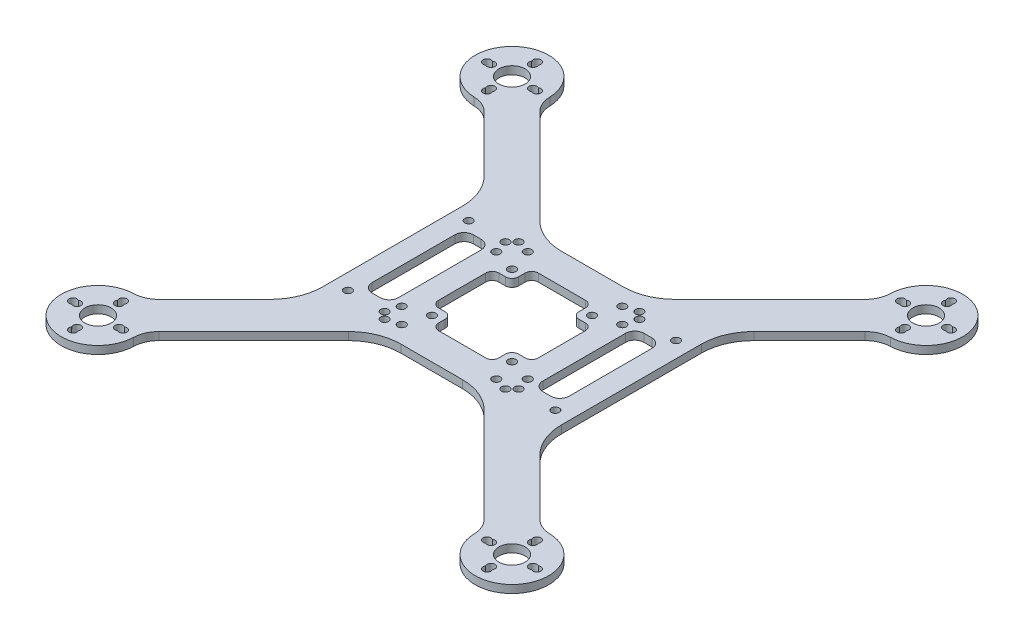
from build123d import *

# Parameters (mm, degrees)
SKETCH_1_R                 = 1.5
EXTRUDE_1_DEPTH            = 3
SKETCH_2_R                 = 1.5
SKETCH_2_R_2               = 5
EXTRUDE_2_DEPTH            = 3
MIRROR_5_COPY_1_SKETCH_R   = 1.5
MIRROR_5_COPY_1_SKETCH_R_2 = 5
MIRROR_5_COPY_1_DEPTH      = 3
FILLET_4_R                 = 20
SKETCH_3_R                 = 1.5
SKETCH_3_W                 = 10
SKETCH_3_H                 = 38.5
CUT_EXTRUDE_1_DEPTH        = 132.333258323
FILLET_6_R                 = 3.5
FILLET_7_R                 = 2.5
SKETCH_4_R                 = 1.5
CUT_EXTRUDE_2_DEPTH        = 132.333258323
PATTERN_CIRCULAR_1_COUNT   = 4


with BuildPart() as part:
    # 草图1 → 凸台-拉伸1 (new body)
    with BuildSketch(Plane(origin=(0, 0, 0), x_dir=(1, 0, 0), z_dir=(0, 1, 0))):
        with BuildLine():
            Line((-42.5, 30.6), (42.5, 30.6))
            ThreePointArc((42.5, 30.6), (44.621320344, 29.721320344), (45.5, 27.6))
            Line((45.5, 27.6), (45.5, -27.6))
            ThreePointArc((45.5, -27.6), (44.621320344, -29.721320344), (42.5, -30.6))
            Line((42.5, -30.6), (-42.5, -30.6))
            ThreePointArc((-42.5, -30.6), (-44.621320344, -29.721320344), (-45.5, -27.6))
            Line((-45.5, -27.6), (-45.5, 27.6))
            ThreePointArc((-45.5, 27.6), (-44.621320344, 29.721320344), (-42.5, 30.6))
        make_face()
        with Locations(Location((-39.5, 23, 0), (0, 0, 270))):
            Circle(SKETCH_1_R, mode=Mode.SUBTRACT)
        with Locations(Location((-25.5, 23, 0), (0, 0, 270))):
            Circle(SKETCH_1_R, mode=Mode.SUBTRACT)
        with Locations(Location((25.5, 23, 0), (0, 0, 270))):
            Circle(SKETCH_1_R, mode=Mode.SUBTRACT)
        with Locations(Location((39.5, 23, 0), (0, 0, 270))):
            Circle(SKETCH_1_R, mode=Mode.SUBTRACT)
        with Locations(Location((-39.5, -23, 0), (0, 0, 270))):
            Circle(SKETCH_1_R, mode=Mode.SUBTRACT)
        with Locations(Location((-25.5, -23, 0), (0, 0, 270))):
            Circle(SKETCH_1_R, mode=Mode.SUBTRACT)
        with Locations(Location((25.5, -23, 0), (0, 0, 270))):
            Circle(SKETCH_1_R, mode=Mode.SUBTRACT)
        with Locations(Location((39.5, -23, 0), (0, 0, 270))):
            Circle(SKETCH_1_R, mode=Mode.SUBTRACT)
        with Locations(Location((-18, 24, 0), (0, 0, 270))):
            Circle(SKETCH_1_R, mode=Mode.SUBTRACT)
        with Locations(Location((18, 24, 0), (0, 0, 270))):
            Circle(SKETCH_1_R, mode=Mode.SUBTRACT)
        with Locations(Location((-18, -24, 0), (0, 0, 270))):
            Circle(SKETCH_1_R, mode=Mode.SUBTRACT)
        with Locations(Location((18, -24, 0), (0, 0, 270))):
            Circle(SKETCH_1_R, mode=Mode.SUBTRACT)
        with Locations(Location((24, -18, 0), (0, 0, 270))):
            Circle(SKETCH_1_R, mode=Mode.SUBTRACT)
        with Locations(Location((24, 18, 0), (0, 0, 270))):
            Circle(SKETCH_1_R, mode=Mode.SUBTRACT)
        with Locations(Location((-24, 18, 0), (0, 0, 270))):
            Circle(SKETCH_1_R, mode=Mode.SUBTRACT)
        with Locations(Location((-24, -18, 0), (0, 0, 270))):
            Circle(SKETCH_1_R, mode=Mode.SUBTRACT)
        with Locations(Location((-23, 25.5, 0), (0, 0, 270))):
            Circle(SKETCH_1_R, mode=Mode.SUBTRACT)
        with Locations(Location((-23, -25.5, 0), (0, 0, 270))):
            Circle(SKETCH_1_R, mode=Mode.SUBTRACT)
        with Locations(Location((23, 25.5, 0), (0, 0, 270))):
            Circle(SKETCH_1_R, mode=Mode.SUBTRACT)
        with Locations(Location((23, -25.5, 0), (0, 0, 270))):
            Circle(SKETCH_1_R, mode=Mode.SUBTRACT)
    extrude(amount=EXTRUDE_1_DEPTH)

    # 草图2 → 凸台-拉伸2 (add)
    with BuildSketch(Plane(origin=(0, 3, 0), x_dir=(1, 0, 0), z_dir=(0, 1, 0))):
        with BuildLine():
            Line((-61.925535594, 72.532137312), (-19.993398282, 30.6))
            Line((-19.993398282, 30.6), (-45.5, 23.412283477))
            Line((-45.5, 23.412283477), (-45.5, 26.609127035))
            ThreePointArc((-45.5, 26.609127035), (-47.02240935, 34.262795682), (-51.357864376, 40.751262658))
            Line((-51.357864376, 40.751262658), (-72.532137312, 61.925535594))
            ThreePointArc((-72.532137312, 61.925535594), (-75.630398524, 64.031439381), (-79.286205531, 64.849442082))
            ThreePointArc((-79.286205531, 64.849442082), (-88.741901039, 88.741901039), (-64.849442082, 79.286205531))
            ThreePointArc((-64.849442082, 79.286205531), (-64.031439381, 75.630398524), (-61.925535594, 72.532137312))
        make_face()
        with Locations(Location((-78.842406102, 88.342406102, 0), (0, 0, 270))):
            Circle(SKETCH_2_R, mode=Mode.SUBTRACT)
        with Locations(Location((-69.342406102, 78.842406102, 0), (0, 0, 270))):
            Circle(SKETCH_2_R, mode=Mode.SUBTRACT)
        with Locations(Location((-78.842406102, 69.342406102, 0), (0, 0, 270))):
            Circle(SKETCH_2_R, mode=Mode.SUBTRACT)
        with Locations(Location((-88.342406102, 78.842406102, 0), (0, 0, 270))):
            Circle(SKETCH_2_R, mode=Mode.SUBTRACT)
        with Locations(Location((-78.842406102, 78.842406102, 0), (0, 0, 270))):
            Circle(SKETCH_2_R_2, mode=Mode.SUBTRACT)
    extrude_2 = extrude(amount=-EXTRUDE_2_DEPTH)

    # 镜向4: 凸台-拉伸2 across plane
    add(extrude_2.mirror(Plane.XY))

    # 镜向5: 凸台-拉伸2 across plane
    add(extrude_2.mirror(Plane(origin=(0, 0, 0), x_dir=(0, 0, 1), z_dir=(1, 0, 0))))

    # 镜向5 copy 1 sketch → 镜向5 copy 1 (add)
    with BuildSketch(Plane(origin=(0, 3, 0), x_dir=(-1, 0, 0), z_dir=(0, 1, 0))):
        with BuildLine():
            Line((-61.925535594, 72.532137312), (-19.993398282, 30.6))
            Line((-19.993398282, 30.6), (-45.5, 23.412283477))
            Line((-45.5, 23.412283477), (-45.5, 26.609127035))
            ThreePointArc((-45.5, 26.609127035), (-47.02240935, 34.262795682), (-51.357864376, 40.751262658))
            Line((-51.357864376, 40.751262658), (-72.532137312, 61.925535594))
            ThreePointArc((-72.532137312, 61.925535594), (-75.630398524, 64.031439381), (-79.286205531, 64.849442082))
            ThreePointArc((-79.286205531, 64.849442082), (-88.741901039, 88.741901039), (-64.849442082, 79.286205531))
            ThreePointArc((-64.849442082, 79.286205531), (-64.031439381, 75.630398524), (-61.925535594, 72.532137312))
        make_face()
        with Locations(Location((-78.842406102, 88.342406102, 0), (0, 0, 270))):
            Circle(MIRROR_5_COPY_1_SKETCH_R, mode=Mode.SUBTRACT)
        with Locations(Location((-69.342406102, 78.842406102, 0), (0, 0, 270))):
            Circle(MIRROR_5_COPY_1_SKETCH_R, mode=Mode.SUBTRACT)
        with Locations(Location((-78.842406102, 69.342406102, 0), (0, 0, 270))):
            Circle(MIRROR_5_COPY_1_SKETCH_R, mode=Mode.SUBTRACT)
        with Locations(Location((-88.342406102, 78.842406102, 0), (0, 0, 270))):
            Circle(MIRROR_5_COPY_1_SKETCH_R, mode=Mode.SUBTRACT)
        with Locations(Location((-78.842406102, 78.842406102, 0), (0, 0, 270))):
            Circle(MIRROR_5_COPY_1_SKETCH_R_2, mode=Mode.SUBTRACT)
    extrude(amount=-MIRROR_5_COPY_1_DEPTH)

    # 圆角4
    fillet_4_edges = [part.edges().sort_by_distance(p)[0] for p in [
        (-19.993398282, 1.5, -30.6),
        (-19.993398282, 1.5, 30.6),
        (19.993398282, 1.5, -30.6),
        (19.993398282, 1.5, 30.6),
    ]]
    fillet(fillet_4_edges, radius=FILLET_4_R)

    # 草图3 → 切除-拉伸1 (cut, through all)
    with BuildSketch(Plane(origin=(0, 3, 0), x_dir=(1, 0, 0), z_dir=(0, 1, 0))):
        with Locations(Location((15.25, 15.25, 0), (0, 0, 270))):
            Circle(SKETCH_3_R)
        with Locations(Location((15.25, -15.25, 0), (0, 0, 270))):
            Circle(SKETCH_3_R)
        with Locations(Location((-15.25, 15.25, 0), (0, 0, 270))):
            Circle(SKETCH_3_R)
        with Locations(Location((-15.25, -15.25, 0), (0, 0, 270))):
            Circle(SKETCH_3_R)
        Polygon((-11.5, 19), (11.5, 19), (11.5, 11.5), (19, 11.5), (19, -11.5), (11.5, -11.5), (11.5, -19), (-11.5, -19), (-11.5, -11.5), (-19, -11.5), (-19, 11.5), (-11.5, 11.5), align=None)
        with Locations((32.5, 0)):
            Rectangle(SKETCH_3_W, SKETCH_3_H)
        with Locations((-32.5, 0)):
            Rectangle(SKETCH_3_W, SKETCH_3_H)
    extrude(amount=-CUT_EXTRUDE_1_DEPTH, mode=Mode.SUBTRACT)

    # 圆角6
    fillet_6_edges = [part.edges().sort_by_distance(p)[0] for p in [
        (27.5, 1.5, 19.25),
        (27.5, 1.5, -19.25),
        (37.5, 1.5, -19.25),
        (37.5, 1.5, 19.25),
        (-27.5, 1.5, 19.25),
        (-37.5, 1.5, 19.25),
        (-37.5, 1.5, -19.25),
        (-27.5, 1.5, -19.25),
    ]]
    fillet(fillet_6_edges, radius=FILLET_6_R)

    # 圆角7
    fillet_7_edges = [part.edges().sort_by_distance(p)[0] for p in [
        (11.5, 1.5, -19),
        (11.5, 1.5, -11.5),
        (19, 1.5, -11.5),
        (19, 1.5, 11.5),
        (11.5, 1.5, 11.5),
        (11.5, 1.5, 19),
        (-11.5, 1.5, 19),
        (-11.5, 1.5, 11.5),
        (-19, 1.5, 11.5),
        (-19, 1.5, -11.5),
        (-11.5, 1.5, -11.5),
        (-11.5, 1.5, -19),
    ]]
    fillet(fillet_7_edges, radius=FILLET_7_R)

    # 草图4 → 切除-拉伸2 (cut, through all)
    with BuildSketch(Plane(origin=(0, 3, 0), x_dir=(1, 0, 0), z_dir=(0, 1, 0))):
        with Locations((-70.842406102, 78.842406102)):
            Circle(SKETCH_4_R)
        with Locations((-78.842406102, 70.842406102)):
            Circle(SKETCH_4_R)
        with Locations((-86.842406102, 78.842406102)):
            Circle(SKETCH_4_R)
        with Locations((-78.842406102, 86.842406102)):
            Circle(SKETCH_4_R)
    cut_extrude_2 = extrude(amount=-CUT_EXTRUDE_2_DEPTH, mode=Mode.SUBTRACT)

    # 阵列(圆周)1: 切除-拉伸2 ×4 about axis
    pattern_circular_1_axis = Axis((0, 0, 0), (0, 1, 0))
    for i in range(1, PATTERN_CIRCULAR_1_COUNT):
        add(cut_extrude_2.rotate(pattern_circular_1_axis, i * 360 / PATTERN_CIRCULAR_1_COUNT), mode=Mode.SUBTRACT)


solid = part.part
